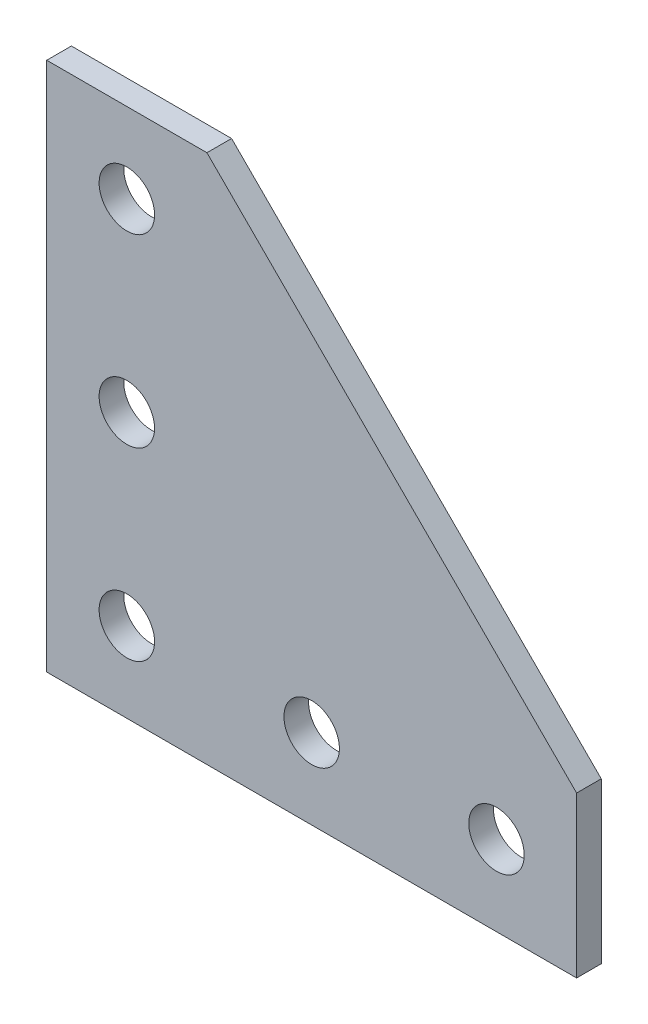
from build123d import *

# Parameters (mm, degrees)
SKETCH1_R           = 7.14375
BOSS_EXTRUDE1_DEPTH = 3.175


with BuildPart() as part:
    # Sketch1 → Boss-Extrude1 (new, symmetric)
    with BuildSketch(Plane.XY):
        Polygon((-88.9, 47.625), (-47.625, 47.625), (47.625, -47.625), (47.625, -88.9), (-88.9, -88.9), align=None)
        with Locations((-68.2625, -68.2625)):
            Circle(SKETCH1_R, mode=Mode.SUBTRACT)
        with Locations((-68.2625, -20.6375)):
            Circle(SKETCH1_R, mode=Mode.SUBTRACT)
        with Locations((-68.2625, 26.9875)):
            Circle(SKETCH1_R, mode=Mode.SUBTRACT)
        with Locations((-20.6375, -68.2625)):
            Circle(SKETCH1_R, mode=Mode.SUBTRACT)
        with Locations((26.9875, -68.2625)):
            Circle(SKETCH1_R, mode=Mode.SUBTRACT)
    extrude(amount=BOSS_EXTRUDE1_DEPTH, both=True)


solid = part.part
